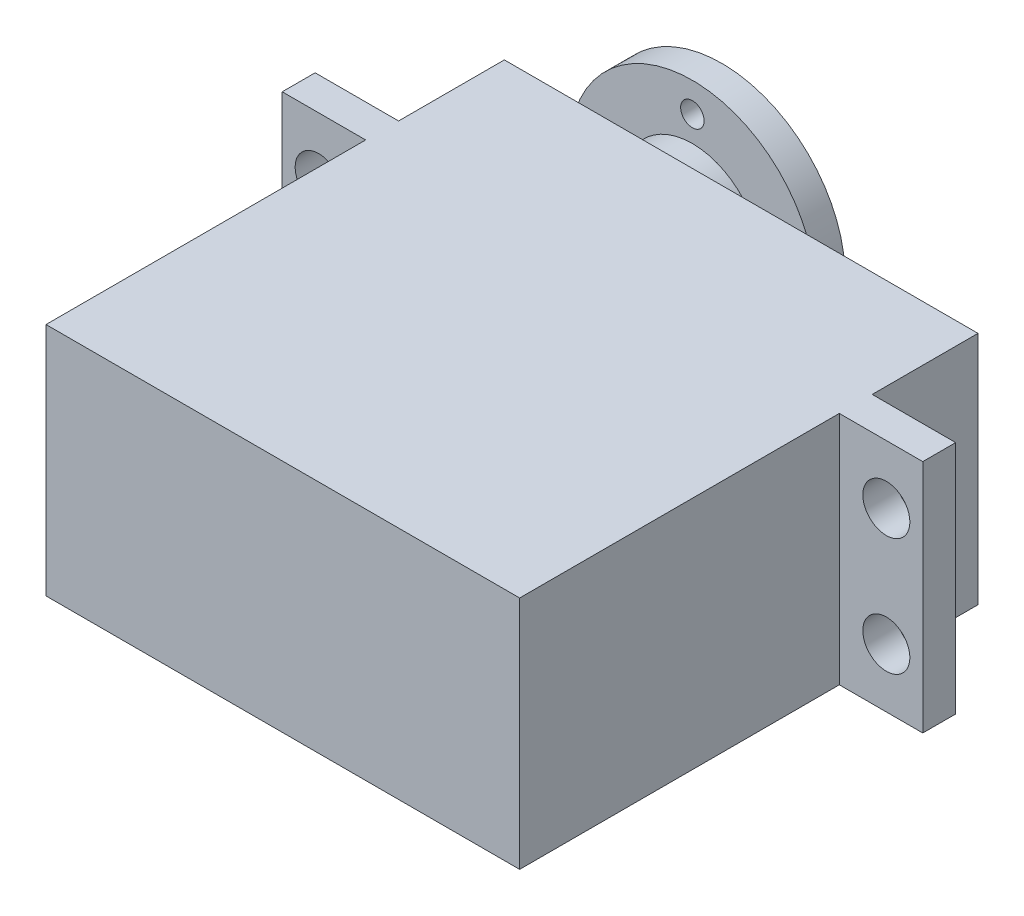
from build123d import *

# Parameters (mm, degrees)
SALIENTE_EXTRUIR1_DEPTH = 20
CROQUIS3_R              = 5.837463161
SALIENTE_EXTRUIR3_DEPTH = 8.5
CROQUIS4_R              = 2
CORTAR_EXTRUIR1_DEPTH   = 10
CROQUIS5_R              = 10.5
SALIENTE_EXTRUIR4_DEPTH = 2.5
CORTAR_EXTRUIR3_REACH   = 60.473
CROQUIS6_R              = 1


with BuildPart() as part:
    # Croquis1 → Saliente-Extruir1 (new body)
    with BuildSketch(Plane(origin=(0, 0, 0), x_dir=(1, 0, 0), z_dir=(0, 1, 0))):
        Polygon((20.15, 19.5), (-20.15, 19.5), (-20.15, 10.5), (-27.25, 10.5), (-27.25, 7.7), (-20.15, 7.7), (-20.15, -19.5), (20.15, -19.5), (20.15, 7.7), (27.25, 7.7), (27.25, 10.5), (20.15, 10.5), align=None)
    extrude(amount=SALIENTE_EXTRUIR1_DEPTH)

    # Croquis3 → Saliente-Extruir3 (add)
    with BuildSketch(Plane(origin=(0, 0, -19.5), x_dir=(-1, 0, 0), z_dir=(0, 0, -1))):
        with Locations(Location((10.15, 10, 0), (0, 0, 180))):
            Circle(CROQUIS3_R)
    extrude(amount=SALIENTE_EXTRUIR3_DEPTH)

    # Croquis4 → Cortar-Extruir1 (cut)
    with BuildSketch(Plane(origin=(0, 0, -10.5), x_dir=(-1, 0, 0), z_dir=(0, 0, -1))):
        with Locations((-24.15, 15)):
            Circle(CROQUIS4_R)
        with Locations((-24.15, 5)):
            Circle(CROQUIS4_R)
        with Locations((24.15, 5)):
            Circle(CROQUIS4_R)
        with Locations((24.15, 15)):
            Circle(CROQUIS4_R)
    extrude(amount=-CORTAR_EXTRUIR1_DEPTH, mode=Mode.SUBTRACT)

    # Croquis5 → Saliente-Extruir4 (add)
    with BuildSketch(Plane(origin=(0, 0, -28), x_dir=(-1, 0, 0), z_dir=(0, 0, -1))):
        with Locations((10.15, 10)):
            Circle(CROQUIS5_R)
    extrude(amount=-SALIENTE_EXTRUIR4_DEPTH)

    # Croquis6 → Cortar-Extruir3 (cut, up to next)
    with BuildSketch(Plane(origin=(0, 0, -28), x_dir=(-1, 0, 0), z_dir=(0, 0, -1)), mode=Mode.PRIVATE) as cortar_extruir3_sk1:
        with Locations((10.15, 18)):
            Circle(CROQUIS6_R)
    cortar_extruir3_tool1 = extrude(cortar_extruir3_sk1.sketch, amount=-CORTAR_EXTRUIR3_REACH, mode=Mode.PRIVATE) & part.part
    # Croquis6 → Cortar-Extruir3 (cut, up to next)
    with BuildSketch(Plane(origin=(0, 0, -28), x_dir=(-1, 0, 0), z_dir=(0, 0, -1)), mode=Mode.PRIVATE) as cortar_extruir3_sk2:
        with Locations((18.15, 10)):
            Circle(CROQUIS6_R)
    cortar_extruir3_tool2 = extrude(cortar_extruir3_sk2.sketch, amount=-CORTAR_EXTRUIR3_REACH, mode=Mode.PRIVATE) & part.part
    # Croquis6 → Cortar-Extruir3 (cut, up to next)
    with BuildSketch(Plane(origin=(0, 0, -28), x_dir=(-1, 0, 0), z_dir=(0, 0, -1)), mode=Mode.PRIVATE) as cortar_extruir3_sk3:
        with Locations((2.15, 10)):
            Circle(CROQUIS6_R)
    cortar_extruir3_tool3 = extrude(cortar_extruir3_sk3.sketch, amount=-CORTAR_EXTRUIR3_REACH, mode=Mode.PRIVATE) & part.part
    # Croquis6 → Cortar-Extruir3 (cut, up to next)
    with BuildSketch(Plane(origin=(0, 0, -28), x_dir=(-1, 0, 0), z_dir=(0, 0, -1)), mode=Mode.PRIVATE) as cortar_extruir3_sk4:
        with Locations((10.15, 2)):
            Circle(CROQUIS6_R)
    cortar_extruir3_tool4 = extrude(cortar_extruir3_sk4.sketch, amount=-CORTAR_EXTRUIR3_REACH, mode=Mode.PRIVATE) & part.part
    add(cortar_extruir3_tool1.solids().sort_by_distance((-10.15, 18, -28))[0], mode=Mode.SUBTRACT)
    add(cortar_extruir3_tool2.solids().sort_by_distance((-18.15, 10, -28))[0], mode=Mode.SUBTRACT)
    add(cortar_extruir3_tool3.solids().sort_by_distance((-2.15, 10, -28))[0], mode=Mode.SUBTRACT)
    add(cortar_extruir3_tool4.solids().sort_by_distance((-10.15, 2, -28))[0], mode=Mode.SUBTRACT)


solid = part.part
